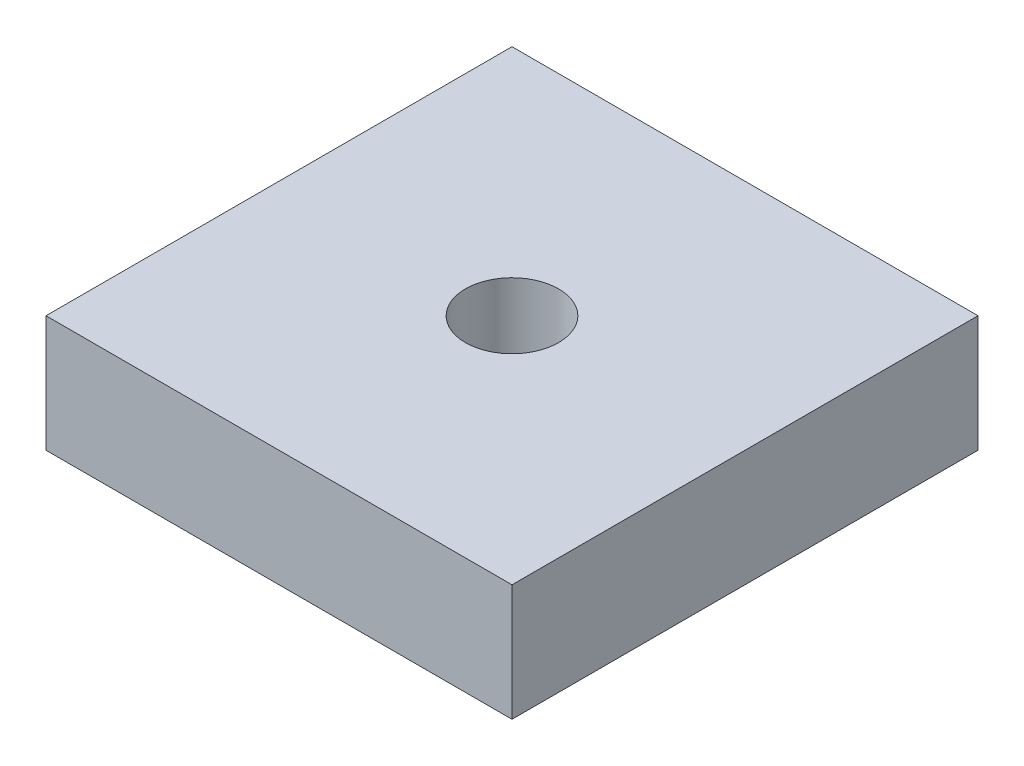
from build123d import *

# Parameters (mm, degrees)
SKETCH1_W           = 10
SKETCH1_H           = 10
SKETCH1_R           = 1
BOSS_EXTRUDE1_DEPTH = 2.5


with BuildPart() as part:
    # Sketch1 → Boss-Extrude1 (new body)
    with BuildSketch(Plane(origin=(0, 0, 0), x_dir=(1, 0, 0), z_dir=(0, 1, 0))):
        Rectangle(SKETCH1_W, SKETCH1_H)
        with Locations(Location((0, 0, 0), (0, 0, 270))):
            Circle(SKETCH1_R, mode=Mode.SUBTRACT)
    extrude(amount=BOSS_EXTRUDE1_DEPTH)


solid = part.part
